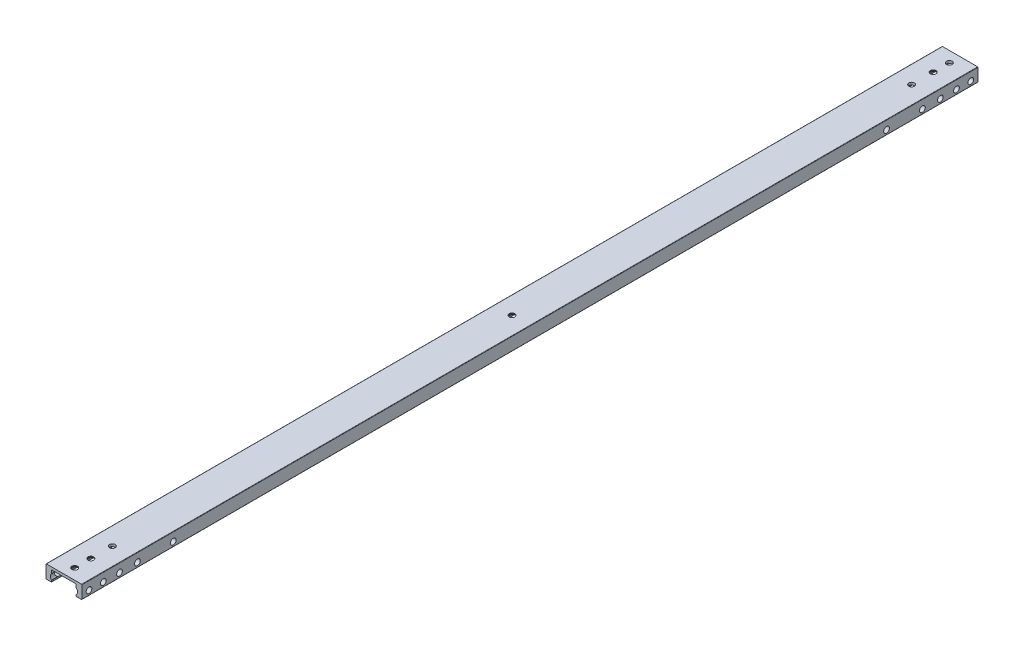
from build123d import *
from OCP.BRepFilletAPI import BRepFilletAPI_MakeChamfer

# Parameters (mm, degrees)
BOSS_EXTRUDE1_DEPTH     = 500
SKETCH4_R               = 1.6
CUT_EXTRUDE1_DEPTH      = 501.135981509
SKETCH5_R               = 1.9
CUT_EXTRUDE2_DEPTH      = 501.113677078
FILLET1_R               = 0.2
CUT_EXTRUDE3_DEPTH      = 501.297523979
CUT_EXTRUDE3_DEPTH_BACK = 501.297523979
SKETCH6_R               = 1.6
CHAMFER3_SIZE           = 1
CHAMFER3_SIZE2          = 0.965688775


with BuildPart() as part:
    # Sketch1 → Boss-Extrude1 (new body)
    with BuildSketch(Plane.XY):
        Polygon((-10, 3.7), (-10, -3.7), (-6.85, -3.7), (-6.85, 2.3), (6.85, 2.3), (6.85, -3.7), (10, -3.7), (10, 3.7), align=None)
    extrude(amount=BOSS_EXTRUDE1_DEPTH)

    # Sketch4 → Cut-Extrude1 (cut, through all)
    with BuildSketch(Plane.XZ.offset(-2.3)):
        with Locations((0, 250)):
            Circle(SKETCH4_R)
        with Locations((0, 15)):
            Circle(SKETCH4_R)
        with Locations(Location((0, 485, 0), (0, 0, 180))):
            Circle(SKETCH4_R)
        with Locations((0, 494)):
            Circle(SKETCH4_R)
        with Locations((0, 473)):
            Circle(SKETCH4_R)
        with Locations(Location((0, 27, 0), (0, 0, 180))):
            Circle(SKETCH4_R)
        with Locations(Location((0, 6, 0), (0, 0, 180))):
            Circle(SKETCH4_R)
    extrude(amount=-CUT_EXTRUDE1_DEPTH, mode=Mode.SUBTRACT)

    # Sketch5 → Cut-Extrude2 (cut, through all)
    with BuildSketch(Plane.XY.offset(500)):
        with Locations((-5.729949702, -1.15)):
            Circle(SKETCH5_R)
        with Locations((5.729949702, -1.15)):
            Circle(SKETCH5_R)
    extrude(amount=-CUT_EXTRUDE2_DEPTH, mode=Mode.SUBTRACT)

    # Fillet1
    fillet1_edges = [part.edges().sort_by_distance(p)[0] for p in [
        (6.85, 2.3, 250),
        (-6.85, 2.3, 250),
        (-6.85, -3.7, 250),
        (-10, -3.7, 250),
        (-10, 3.7, 250),
        (10, 3.7, 250),
        (10, -3.7, 250),
        (6.85, -3.7, 250),
        (-6.85, -2.684759698, 250),
        (-6.85, 0.384759698, 250),
        (6.85, -2.684759698, 250),
        (6.85, 0.384759698, 250),
    ]]
    fillet(fillet1_edges, radius=FILLET1_R)

    # Sketch6 → Cut-Extrude3 (cut, two sides: drawn at the far end of the back side and taken through both)
    with BuildSketch(Plane(origin=(-6.85, 0, 0), x_dir=(0, 0, -1), z_dir=(1, 0, 0)).offset(-CUT_EXTRUDE3_DEPTH_BACK)):
        with Locations((-496, -1.15)):
            Circle(SKETCH6_R)
        with Locations(Location((-488, -1.15, 0), (0, 0, 67.451692584))):
            Circle(SKETCH6_R)
        with Locations((-12, -1.15)):
            Circle(SKETCH6_R)
        with Locations((-4, -1.15)):
            Circle(SKETCH6_R)
        with Locations((-469, -1.15)):
            Circle(SKETCH6_R)
        with Locations((-449, -1.15)):
            Circle(SKETCH6_R)
        with Locations((-479, -1.15)):
            Circle(SKETCH6_R)
        with Locations(Location((-51, -1.15, 0), (0, 0, 67.451692584))):
            Circle(SKETCH6_R)
        with Locations(Location((-31, -1.15, 0), (0, 0, 67.451692584))):
            Circle(SKETCH6_R)
        with Locations(Location((-21, -1.15, 0), (0, 0, 67.451692584))):
            Circle(SKETCH6_R)
    extrude(amount=CUT_EXTRUDE3_DEPTH + CUT_EXTRUDE3_DEPTH_BACK, mode=Mode.SUBTRACT)

    # Chamfer3: one chamfer whose edges measure the first distance from different faces: ONE call of the kernel's chamfer builder (chamfer() names one face for all edges)
    chamfer3_edges_1 = [part.edges().sort_by_distance(p)[0] for p in [
        (-1.6, 2.3, 494),
    ]]
    chamfer3_side_1 = [part.faces().sort_by_distance(p)[0] for p in [
        (-1.6, 3, 494),
    ]]
    chamfer3_edges_2 = [part.edges().sort_by_distance(p)[0] for p in [
        (1.6, 2.3, 485),
    ]]
    chamfer3_side_2 = [part.faces().sort_by_distance(p)[0] for p in [
        (1.6, 3, 485),
    ]]
    chamfer3_edges_3 = [part.edges().sort_by_distance(p)[0] for p in [
        (-1.6, 2.3, 15),
    ]]
    chamfer3_side_3 = [part.faces().sort_by_distance(p)[0] for p in [
        (-1.6, 3, 15),
    ]]
    chamfer3_edges_4 = [part.edges().sort_by_distance(p)[0] for p in [
        (-1.6, 2.3, 250),
    ]]
    chamfer3_side_4 = [part.faces().sort_by_distance(p)[0] for p in [
        (-1.6, 3, 250),
    ]]
    chamfer3 = BRepFilletAPI_MakeChamfer(part.part.solid().wrapped)
    for e in chamfer3_edges_1:
        chamfer3.Add(CHAMFER3_SIZE, CHAMFER3_SIZE2, e.wrapped, chamfer3_side_1[0].wrapped)  # the first distance lies on this face
    for e in chamfer3_edges_2:
        chamfer3.Add(CHAMFER3_SIZE, CHAMFER3_SIZE2, e.wrapped, chamfer3_side_2[0].wrapped)  # the first distance lies on this face
    for e in chamfer3_edges_3:
        chamfer3.Add(CHAMFER3_SIZE, CHAMFER3_SIZE2, e.wrapped, chamfer3_side_3[0].wrapped)  # the first distance lies on this face
    for e in chamfer3_edges_4:
        chamfer3.Add(CHAMFER3_SIZE, CHAMFER3_SIZE2, e.wrapped, chamfer3_side_4[0].wrapped)  # the first distance lies on this face
    add(Compound.cast(chamfer3.Shape()), mode=Mode.REPLACE)


solid = part.part
